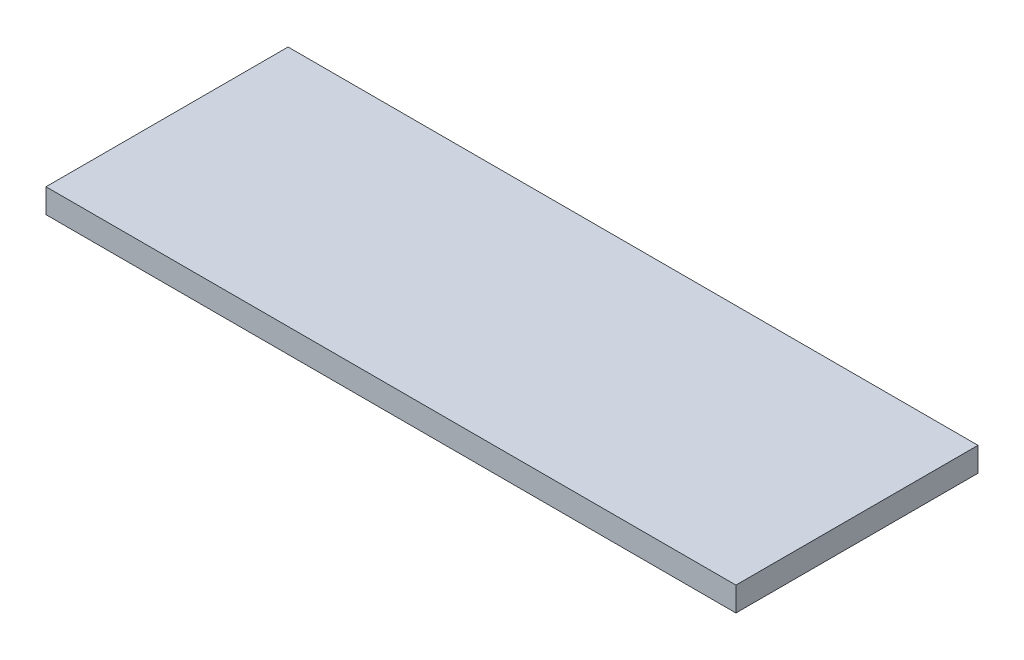
from build123d import *

# Parameters (mm, degrees)
SKETCH1_W             = 28.5
SKETCH1_H             = 10
BOSS_EXTRUDE1_DEPTH   = 1
BODY_MOVE_COPY1_ANGLE = 90


with BuildPart() as part:
    # Sketch1 → Boss-Extrude1 (new body)
    with BuildSketch(Plane.XY):
        with Locations((-30.061111111, 15.105555556)):
            Rectangle(SKETCH1_W, SKETCH1_H)
    extrude(amount=BOSS_EXTRUDE1_DEPTH)


with BuildPart() as part_1:
    # Body-Move/Copy1: moved
    add(part.part.rotate(Axis((0, 15.105555556, 0.25), (1, 0, 0)), BODY_MOVE_COPY1_ANGLE))


solid = part_1.part
